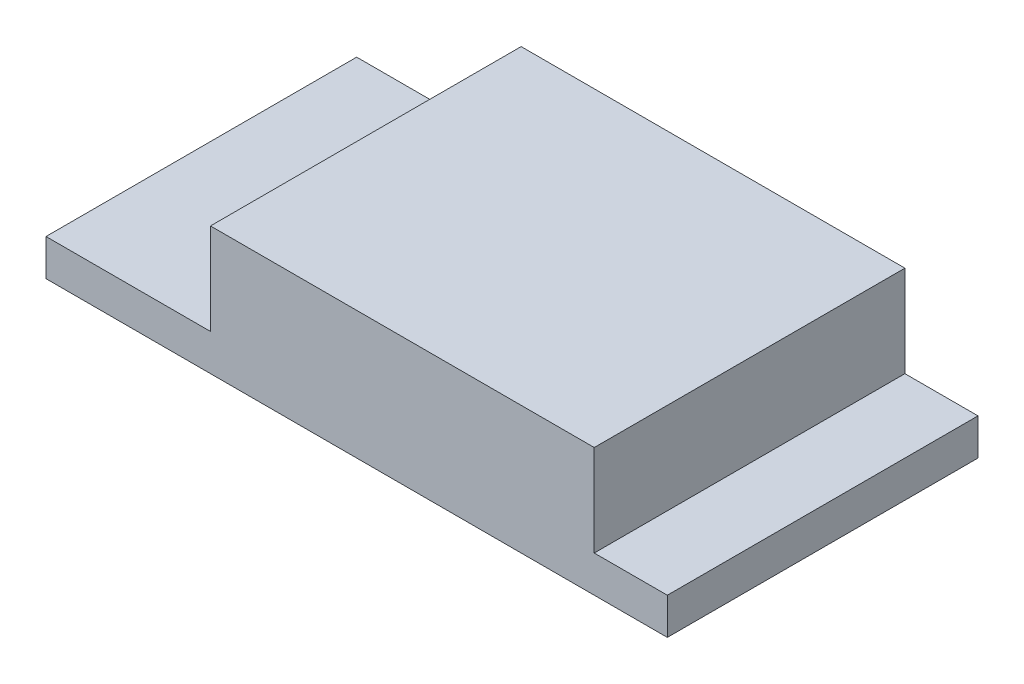
from build123d import *

# Parameters (mm, degrees)
SKETCH1_W           = 34
SKETCH1_H           = 17
BOSS_EXTRUDE1_DEPTH = 2
SKETCH3_W           = 21
SKETCH3_H           = 17
BOSS_EXTRUDE3_DEPTH = 5


with BuildPart() as part:
    # Sketch1 → Boss-Extrude1 (new body)
    with BuildSketch(Plane(origin=(0, 0, 0), x_dir=(1, 0, 0), z_dir=(0, 1, 0))):
        Rectangle(SKETCH1_W, SKETCH1_H)
    extrude(amount=BOSS_EXTRUDE1_DEPTH)

    # Sketch3 → Boss-Extrude3 (add)
    with BuildSketch(Plane(origin=(0, 2, 0), x_dir=(1, 0, 0), z_dir=(0, 1, 0))):
        with Locations((2.5, 0)):
            Rectangle(SKETCH3_W, SKETCH3_H)
    extrude(amount=BOSS_EXTRUDE3_DEPTH)


solid = part.part
